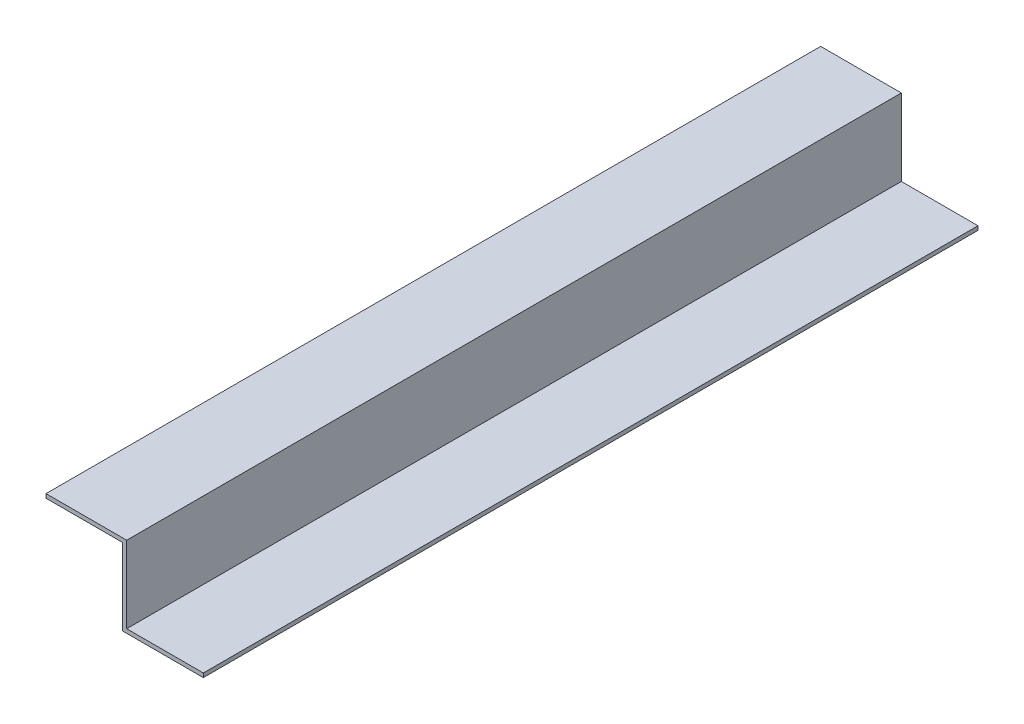
from build123d import *

# Parameters (mm, degrees)
BOSS_EXTRUDE1_DEPTH      = 152.4
BOSS_EXTRUDE1_DEPTH_BACK = 152.4


with BuildPart() as part:
    # Sketch3 → Boss-Extrude1 (new, two sides: drawn at the far end of the back side and taken through both)
    with BuildSketch(Plane.XY.offset(-BOSS_EXTRUDE1_DEPTH_BACK)):
        Polygon((30.95625, -14.2875), (30.95625, -15.875), (-0.79375, -15.875), (-0.79375, 14.2875), (-30.95625, 14.2875), (-30.95625, 15.875), (0.79375, 15.875), (0.79375, -14.2875), align=None)
    extrude(amount=BOSS_EXTRUDE1_DEPTH + BOSS_EXTRUDE1_DEPTH_BACK)


solid = part.part
